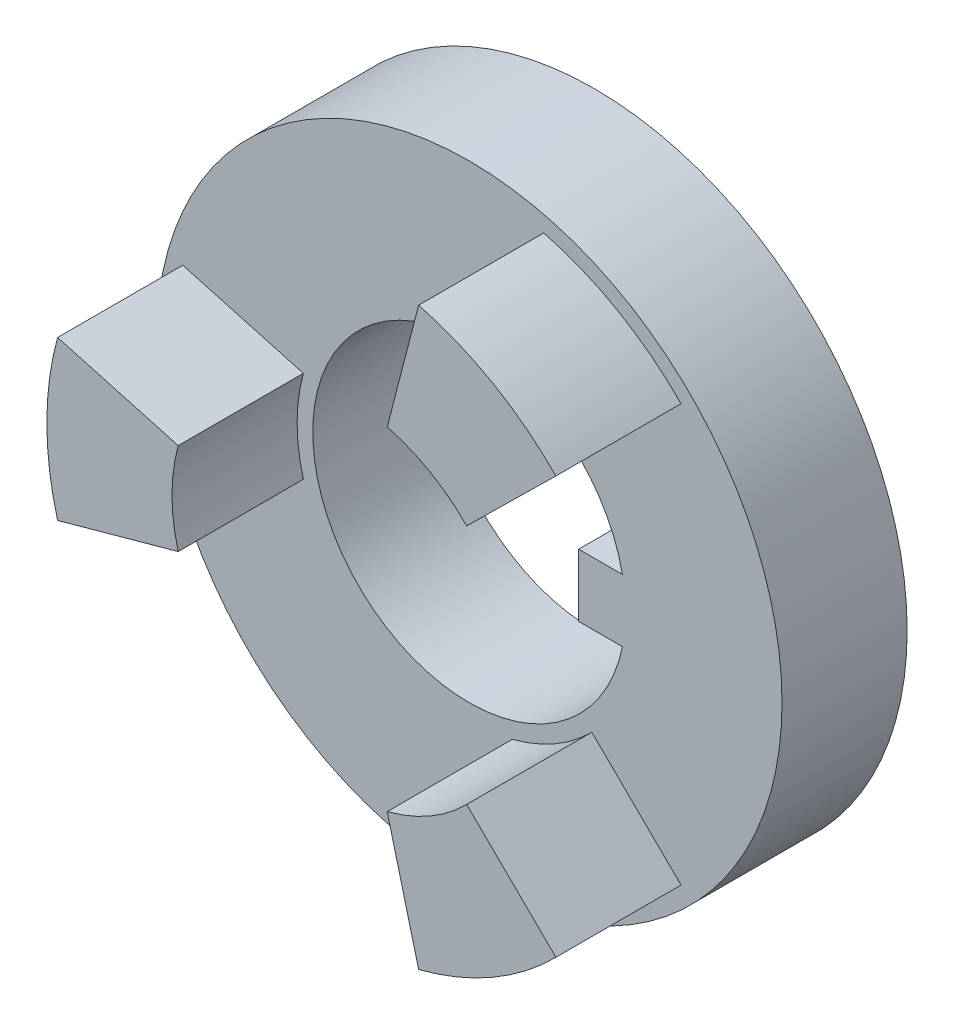
from build123d import *

# Parameters (mm, degrees)
SKETCH1_R           = 10
SKETCH1_R_2         = 5
BOSS_EXTRUDE2_DEPTH = 4
BOSS_EXTRUDE3_DEPTH = 4
SKETCH3_W           = 3
SKETCH3_H           = 2
BOSS_EXTRUDE4_DEPTH = 4


with BuildPart() as part:
    # Sketch1 → Boss-Extrude2 (new body)
    with BuildSketch(Plane.XY):
        Circle(SKETCH1_R)
        Circle(SKETCH1_R_2, mode=Mode.SUBTRACT)
    extrude(amount=BOSS_EXTRUDE2_DEPTH)

    # Sketch2 → Boss-Extrude3 (add)
    with BuildSketch(Plane.XY.offset(4)):
        with BuildLine():
            ThreePointArc((-5.5, 0), (-5.449982192, 0.74006358), (-5.300838508, 1.466666667))
            Line((-5.300838508, 1.466666667), (-9.155993787, 2.533333333))
            ThreePointArc((-9.155993787, 2.533333333), (-9.413605605, 1.278291639), (-9.5, 0))
            ThreePointArc((-9.5, 0), (-9.413605605, -1.278291639), (-9.155993787, -2.533333333))
            Line((-9.155993787, -2.533333333), (-5.300838508, -1.466666667))
            ThreePointArc((-5.300838508, -1.466666667), (-5.449982192, -0.74006358), (-5.5, 0))
        make_face()
        with BuildLine():
            ThreePointArc((3.920589846, -3.857327476), (2.75, -4.763139721), (1.380248662, -5.323994143))
            Line((1.380248662, -5.323994143), (2.38406587, -9.195989883))
            ThreePointArc((2.38406587, -9.195989883), (4.75, -8.227241336), (6.771927916, -6.66265655))
            Line((6.771927916, -6.66265655), (3.920589846, -3.857327476))
        make_face()
        with BuildLine():
            Line((2.38406587, 9.195989883), (1.380248662, 5.323994143))
            ThreePointArc((1.380248662, 5.323994143), (2.75, 4.763139721), (3.920589846, 3.857327476))
            Line((3.920589846, 3.857327476), (6.771927916, 6.66265655))
            ThreePointArc((6.771927916, 6.66265655), (4.75, 8.227241336), (2.38406587, 9.195989883))
        make_face()
    extrude(amount=BOSS_EXTRUDE3_DEPTH)

    # Sketch3 → Boss-Extrude4 (add)
    with BuildSketch(Plane(origin=(0, 0, 0), x_dir=(-1, 0, 0), z_dir=(0, 0, -1))):
        with Locations((-5, 0)):
            Rectangle(SKETCH3_W, SKETCH3_H)
    extrude(amount=-BOSS_EXTRUDE4_DEPTH)


solid = part.part
